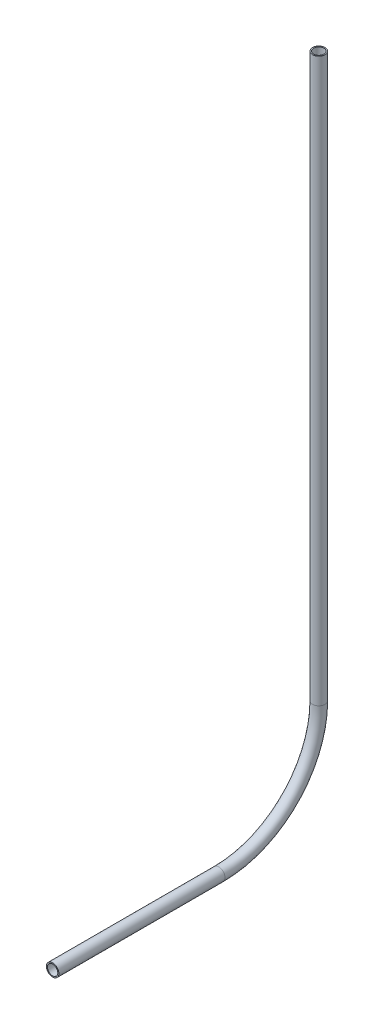
from build123d import *

# Parameters (mm, degrees)
SKETCH11_R                = 3.175
SKETCH11_R_2              = 2.6162
PIPE_0_5_SCH_40_1_DEPTH   = 84.375370327
SKETCH11_ON_SEGMENT_2_R   = 3.175
SKETCH11_ON_SEGMENT_2_R_2 = 2.6162
PIPE_0_5_SCH_40_1_2_ANGLE = 90
SKETCH11_ON_SEGMENT_3_R   = 3.175
SKETCH11_ON_SEGMENT_3_R_2 = 2.6162
PIPE_0_5_SCH_40_1_3_DEPTH = 285.720267902


with BuildPart() as part:
    # Sketch11 → Pipe 0.5 SCH 40(1) (new body)
    with BuildSketch(Plane(origin=(0, 164.302951268, 142.296320697), x_dir=(0, 1, 0), z_dir=(0, 0, -1))):
        Circle(SKETCH11_R)
        Circle(SKETCH11_R_2, mode=Mode.SUBTRACT)
    extrude(amount=PIPE_0_5_SCH_40_1_DEPTH)


with BuildPart() as body_2:
    # Sketch11 on segment 2 (carried to the start of arc 2) → Pipe 0.5 SCH 40_1 2 (revolve)
    with BuildSketch(Plane(origin=(0, 164.302951268, 57.920950369), x_dir=(0, 1, 0), z_dir=(0, 0, -1))):
        Circle(SKETCH11_ON_SEGMENT_2_R)
        Circle(SKETCH11_ON_SEGMENT_2_R_2, mode=Mode.SUBTRACT)
    revolve(axis=Axis((0, 215.102951268, 57.920950369), (1, 0, 0)), revolution_arc=PIPE_0_5_SCH_40_1_2_ANGLE)


with BuildPart() as body_3:
    # Sketch11 on segment 3 (carried to segment 3) → Pipe 0.5 SCH 40_1 3 (new body)
    with BuildSketch(Plane(origin=(0, 215.102951268, 7.120950369), x_dir=(0, 0, 1), z_dir=(0, 1, 0))):
        Circle(SKETCH11_ON_SEGMENT_3_R)
        Circle(SKETCH11_ON_SEGMENT_3_R_2, mode=Mode.SUBTRACT)
    extrude(amount=PIPE_0_5_SCH_40_1_3_DEPTH)


solid = Compound([part.part, body_2.part, body_3.part])
